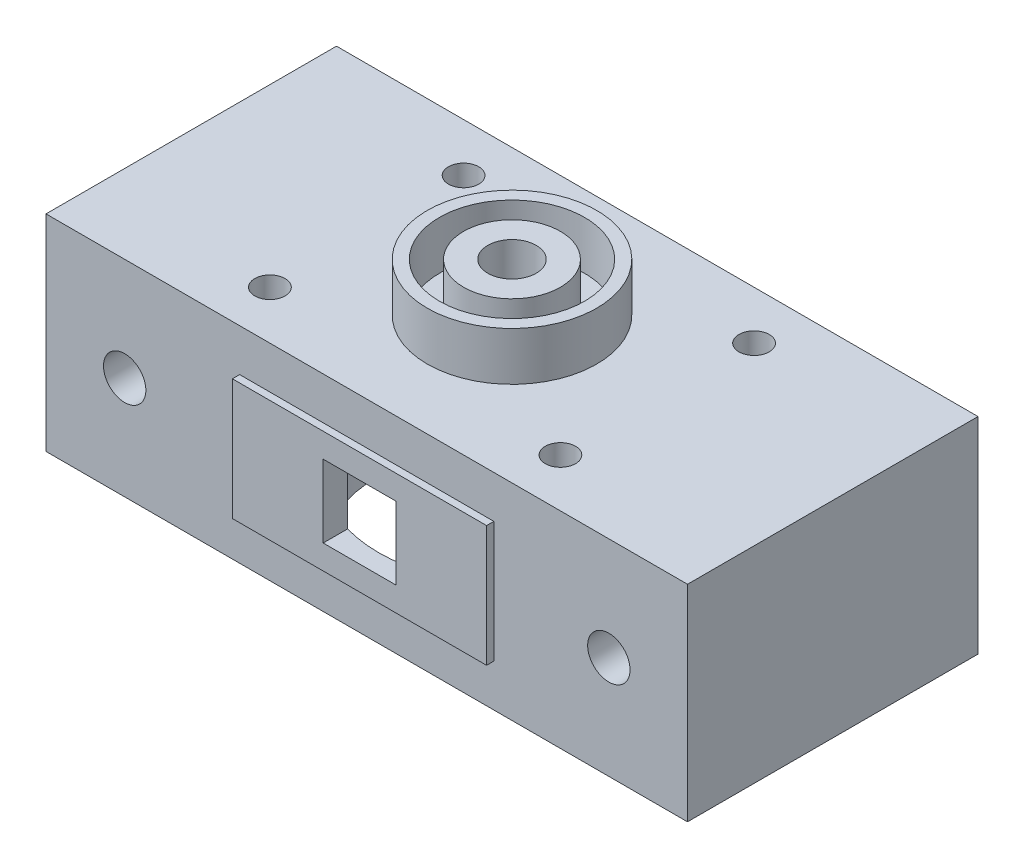
from build123d import *

# Parameters (mm, degrees)
SKETCH_1_R          = 1.75
EXTRUDE_1_DEPTH     = 12
SKETCH_3_R          = 2
CUT_EXTRUDE_1_DEPTH = 34.693471178
SKETCH_4_W          = 22.4
SKETCH_4_H          = 14.3
SKETCH_4_W_2        = 6
SKETCH_4_H_2        = 6
EXTRUDE_2_DEPTH     = 1.2
SKETCH_5_W          = 21
SKETCH_5_H          = 10
SKETCH_5_W_2        = 6
SKETCH_5_H_2        = 6
EXTRUDE_3_DEPTH     = 0.6
SKETCH_14_W         = 24.4
SKETCH_14_H         = 23.6
EXTRUDE_6_DEPTH     = 14.3
CUT_EXTRUDE_START   = 2.7
SKETCH_12_R         = 11
CUT_EXTRUDE_6_DEPTH = 14.3
SKETCH_15_W         = 6
SKETCH_15_H         = 6
CUT_EXTRUDE_7_DEPTH = 40.832273347
EXTRUDE_START       = 4
SKETCH_6_R          = 7
SKETCH_6_R_2        = 6
SKETCH_6_R_3        = 4
SKETCH_6_R_4        = 2
EXTRUDE_4_DEPTH     = 4
M3X0_51_D           = 2.5
M3X0_51_DEPTH       = 11.5
M3X0_51_TIP         = 0.751075774


with BuildPart() as part:
    # Эскиз1 → Бобышка-Вытянуть1 (new, symmetric)
    with BuildSketch(Plane.XY):
        Polygon((11.2, -17), (11.2, -2.7), (0, -2.7), (0, 0), (26.5, 0), (26.5, -17), align=None)
        with Locations((20, -8.5)):
            Circle(SKETCH_1_R, mode=Mode.SUBTRACT)
    extrude_1 = extrude(amount=EXTRUDE_1_DEPTH, both=True)

    # Зеркальное отражение1: Бобышка-Вытянуть1 across plane
    add(extrude_1.mirror(Plane(origin=(0, -2.7, -12), x_dir=(0, 0, 1), z_dir=(-1, 0, 0))))

    # Эскиз3 → Вырез-Вытянуть1 (cut, through all)
    with BuildSketch(Plane(origin=(0, 0, 0), x_dir=(1, 0, 0), z_dir=(0, 1, 0))):
        with Locations(Location((0, 0, 0), (0, 0, 270))):
            Circle(SKETCH_3_R)
    extrude(amount=-CUT_EXTRUDE_1_DEPTH, mode=Mode.SUBTRACT)

    # Эскиз4 → Бобышка-Вытянуть2 (add)
    with BuildSketch(Plane(origin=(0, 0, -12), x_dir=(-1, 0, 0), z_dir=(0, 0, -1))):
        with Locations((0, -9.85)):
            Rectangle(SKETCH_4_W, SKETCH_4_H)
        with Locations((0, -8.5)):
            Rectangle(SKETCH_4_W_2, SKETCH_4_H_2, mode=Mode.SUBTRACT)
    extrude_2 = extrude(amount=-EXTRUDE_2_DEPTH)

    # Эскиз5 → Бобышка-Вытянуть3 (add)
    with BuildSketch(Plane(origin=(0, 0, -12), x_dir=(-1, 0, 0), z_dir=(0, 0, -1))):
        with Locations((0, -8.5)):
            Rectangle(SKETCH_5_W, SKETCH_5_H)
        with Locations((0, -8.5)):
            Rectangle(SKETCH_5_W_2, SKETCH_5_H_2, mode=Mode.SUBTRACT)
    extrude_3 = extrude(amount=EXTRUDE_3_DEPTH)

    # Зеркальное отражение2: Бобышка-Вытянуть2, Бобышка-Вытянуть3 across plane
    add(extrude_2.mirror(Plane.XY))
    add(extrude_3.mirror(Plane.XY))

    # Эскиз14 → Бобышка-Вытянуть6 (add)
    with BuildSketch(Plane.XZ.offset(2.7)):
        Rectangle(SKETCH_14_W, SKETCH_14_H)
    extrude(amount=EXTRUDE_6_DEPTH)

    # Эскиз12 → Вырез-Вытянуть6 (cut)
    with BuildSketch(Plane.XZ.offset(CUT_EXTRUDE_START)):
        Circle(SKETCH_12_R)
    extrude(amount=CUT_EXTRUDE_6_DEPTH, mode=Mode.SUBTRACT)

    # Эскиз15 → Вырез-Вытянуть7 (cut, through all)
    with BuildSketch(Plane.XY.offset(11.8)):
        with Locations((0, -8.5)):
            Rectangle(SKETCH_15_W, SKETCH_15_H)
    extrude(amount=-CUT_EXTRUDE_7_DEPTH, mode=Mode.SUBTRACT)

    # Эскиз6 → Бобышка-Вытянуть4 (add)
    # profile 1 of 2: a face of its own
    with BuildSketch(Plane(origin=(0, 0, 0), x_dir=(1, 0, 0), z_dir=(0, 1, 0)).offset(EXTRUDE_START)):
        with Locations(Location((0, 0, 0), (0, 0, 270))):
            Circle(SKETCH_6_R)
        with Locations(Location((0, 0, 0), (0, 0, 270))):
            Circle(SKETCH_6_R_2, mode=Mode.SUBTRACT)
    # profile 2 of 2: a face of its own
    with BuildSketch(Plane(origin=(0, 0, 0), x_dir=(1, 0, 0), z_dir=(0, 1, 0)).offset(EXTRUDE_START)):
        with Locations(Location((0, 0, 0), (0, 0, 270))):
            Circle(SKETCH_6_R_3)
        with Locations(Location((0, 0, 0), (0, 0, 270))):
            Circle(SKETCH_6_R_4, mode=Mode.SUBTRACT)
    extrude(amount=-EXTRUDE_4_DEPTH)

    # Отверстие обработанное метчиком M3x0.51
    with Locations(Plane(origin=(0, 0, 0), x_dir=(1, 0, 0), z_dir=(0, 1, 0))):
        with Locations((12, 8), (12, -8), (-12, -8), (-12, 8)):
            Hole(M3X0_51_D / 2, depth=M3X0_51_DEPTH)
            with Locations((0, 0, -(M3X0_51_DEPTH + M3X0_51_TIP / 2))):  # 118° drill point
                Cone(0, M3X0_51_D / 2, M3X0_51_TIP, mode=Mode.SUBTRACT)


solid = part.part
